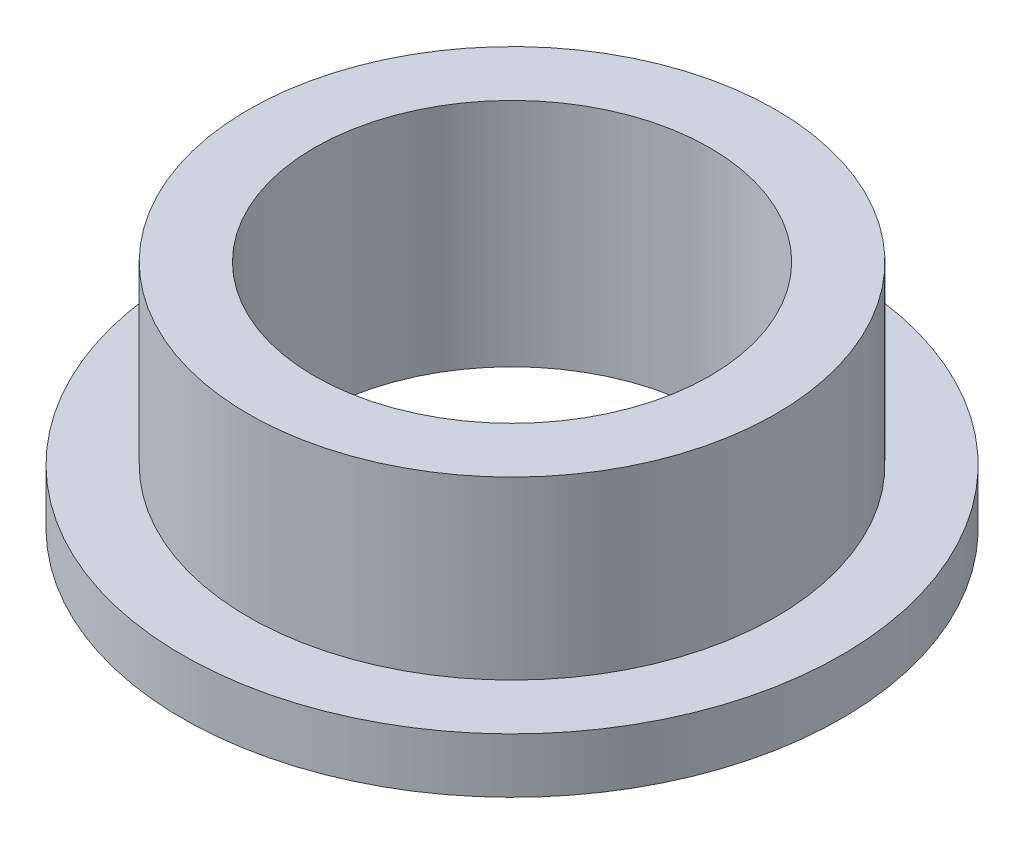
from build123d import *


with BuildPart() as part:
    # Sketch1 → Revolve1 (revolve)
    with BuildSketch(Plane.XY, mode=Mode.PRIVATE) as revolve1_sk:
        Polygon((18, 0), (18, 21), (24, 21), (24, 5), (30, 5), (30, 0), align=None)
    revolve(revolve1_sk.sketch.rotate(Axis((0, 0, 0), (0, 1, 0)), 90), axis=Axis((0, 0, 0), (0, 1, 0)))


solid = part.part
